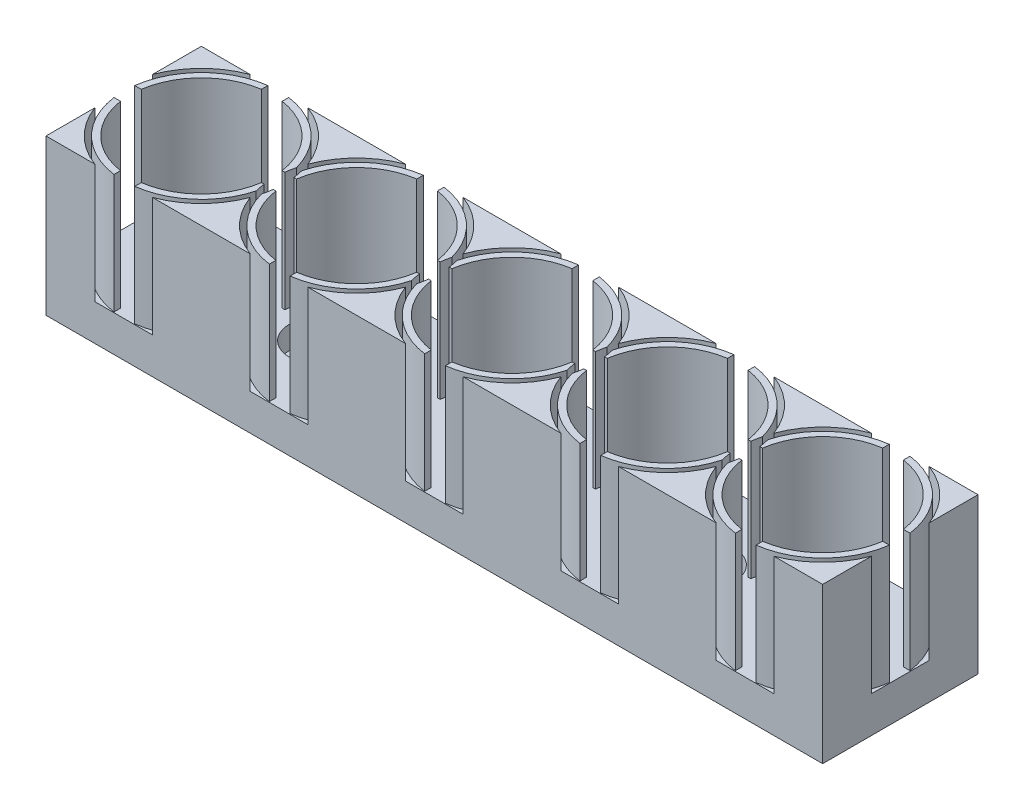
from build123d import *

# Parameters (mm, degrees)
SKETCH2_W                                           = 150
SKETCH2_H                                           = 30
BOSS_EXTRUDE1_DEPTH                                 = 30
SKETCH3_R                                           = 13.75
CUT_EXTRUDE1_DEPTH                                  = 23
LPATTERN1_COUNT                                     = 5
LPATTERN1_PITCH                                     = 30
CBORE_FOR_M4_HEX_SOCKET_HEAD_CAP_SCREW1_D           = 4.5
CBORE_FOR_M4_HEX_SOCKET_HEAD_CAP_SCREW1_CBORE_D     = 8
CBORE_FOR_M4_HEX_SOCKET_HEAD_CAP_SCREW1_CBORE_DEPTH = 4.4
LPATTERN2_COUNT                                     = 2
LPATTERN2_PITCH                                     = 120
SKETCH7_W                                           = 181.12901383
SKETCH7_H                                           = 4
CUT_EXTRUDE3_DEPTH                                  = 23
SKETCH8_W                                           = 4
SKETCH8_H                                           = 50
CUT_EXTRUDE4_DEPTH                                  = 23
SKIZZE1_R                                           = 16
SKIZZE1_R_2                                         = 15
SCHNITT_LINEAR_AUSTRAGEN1_DEPTH                     = 80.868642157
LPATTERN3_COUNT                                     = 5
LPATTERN3_PITCH                                     = 30
CBORE_FOR_M6_HEX_SOCKET_HEAD_CAP_SCREW1_D           = 6.6
CBORE_FOR_M6_HEX_SOCKET_HEAD_CAP_SCREW1_CBORE_D     = 11
CBORE_FOR_M6_HEX_SOCKET_HEAD_CAP_SCREW1_CBORE_DEPTH = 4.4
LPATTERN4_COUNT                                     = 2
LPATTERN4_PITCH                                     = 75


with BuildPart() as part:
    # Sketch2 → Boss-Extrude1 (new body)
    with BuildSketch(Plane(origin=(0, 0, 0), x_dir=(1, 0, 0), z_dir=(0, 1, 0))):
        Rectangle(SKETCH2_W, SKETCH2_H)
    extrude(amount=BOSS_EXTRUDE1_DEPTH)

    # Sketch3 → Cut-Extrude1 (cut)
    with BuildSketch(Plane(origin=(0, 30, 0), x_dir=(1, 0, 0), z_dir=(0, 1, 0))):
        with Locations(Location((-60, 0, 0), (0, 0, 270))):
            Circle(SKETCH3_R)
    cut_extrude1 = extrude(amount=-CUT_EXTRUDE1_DEPTH, mode=Mode.SUBTRACT)

    # LPattern1: Cut-Extrude1 ×5
    with Locations(*[(i * LPATTERN1_PITCH, 0, 0) for i in range(1, LPATTERN1_COUNT)]):
        add(cut_extrude1, mode=Mode.SUBTRACT)

    # CBORE for M4 Hex Socket Head Cap Screw1 (through all)
    with Locations(Plane(origin=(0, 7, 0), x_dir=(-1, 0, 0), z_dir=(0, 1, 0))):
        with Locations((60, 0)):
            cbore_for_m4_hex_socket_head_cap_screw1 = CounterBoreHole(CBORE_FOR_M4_HEX_SOCKET_HEAD_CAP_SCREW1_D / 2, CBORE_FOR_M4_HEX_SOCKET_HEAD_CAP_SCREW1_CBORE_D / 2, CBORE_FOR_M4_HEX_SOCKET_HEAD_CAP_SCREW1_CBORE_DEPTH)

    # LPattern2: CBORE for M4 Hex Socket Head Cap Screw1 ×2
    with Locations(*[(i * LPATTERN2_PITCH, 0, 0) for i in range(1, LPATTERN2_COUNT)]):
        add(cbore_for_m4_hex_socket_head_cap_screw1, mode=Mode.SUBTRACT)

    # Sketch7 → Cut-Extrude3 (cut)
    with BuildSketch(Plane(origin=(0, 30, 0), x_dir=(1, 0, 0), z_dir=(0, 1, 0))):
        Rectangle(SKETCH7_W, SKETCH7_H)
    extrude(amount=-CUT_EXTRUDE3_DEPTH, mode=Mode.SUBTRACT)

    # Sketch8 → Cut-Extrude4 (cut)
    with BuildSketch(Plane(origin=(0, 30, 0), x_dir=(-1, 0, 0), z_dir=(0, 1, 0))):
        with Locations((60, -1.298701607)):
            Rectangle(SKETCH8_W, SKETCH8_H)
    cut_extrude4 = extrude(amount=-CUT_EXTRUDE4_DEPTH, mode=Mode.SUBTRACT)

    # Skizze1 → Schnitt-Linear austragen1 (cut, through all)
    with BuildSketch(Plane(origin=(0, 7, 0), x_dir=(-1, 0, 0), z_dir=(0, 1, 0))):
        with Locations((60, 0)):
            Circle(SKIZZE1_R)
        with Locations((60, 0)):
            Circle(SKIZZE1_R_2, mode=Mode.SUBTRACT)
    schnitt_linear_austragen1 = extrude(amount=SCHNITT_LINEAR_AUSTRAGEN1_DEPTH, mode=Mode.SUBTRACT)

    # LPattern3: Cut-Extrude4, Schnitt-Linear austragen1 ×5
    with Locations(*[(i * LPATTERN3_PITCH, 0, 0) for i in range(1, LPATTERN3_COUNT)]):
        add(cut_extrude4, mode=Mode.SUBTRACT)
        add(schnitt_linear_austragen1, mode=Mode.SUBTRACT)

    # CBORE for M6 Hex Socket Head Cap Screw1 (through all)
    with Locations(Plane(origin=(0, 7, 0), x_dir=(-1, 0, 0), z_dir=(0, 1, 0))):
        with Locations((37.5, 0)):
            cbore_for_m6_hex_socket_head_cap_screw1 = CounterBoreHole(CBORE_FOR_M6_HEX_SOCKET_HEAD_CAP_SCREW1_D / 2, CBORE_FOR_M6_HEX_SOCKET_HEAD_CAP_SCREW1_CBORE_D / 2, CBORE_FOR_M6_HEX_SOCKET_HEAD_CAP_SCREW1_CBORE_DEPTH)

    # LPattern4: CBORE for M6 Hex Socket Head Cap Screw1 ×2
    with Locations(*[(i * LPATTERN4_PITCH, 0, 0) for i in range(1, LPATTERN4_COUNT)]):
        add(cbore_for_m6_hex_socket_head_cap_screw1, mode=Mode.SUBTRACT)


solid = part.part
